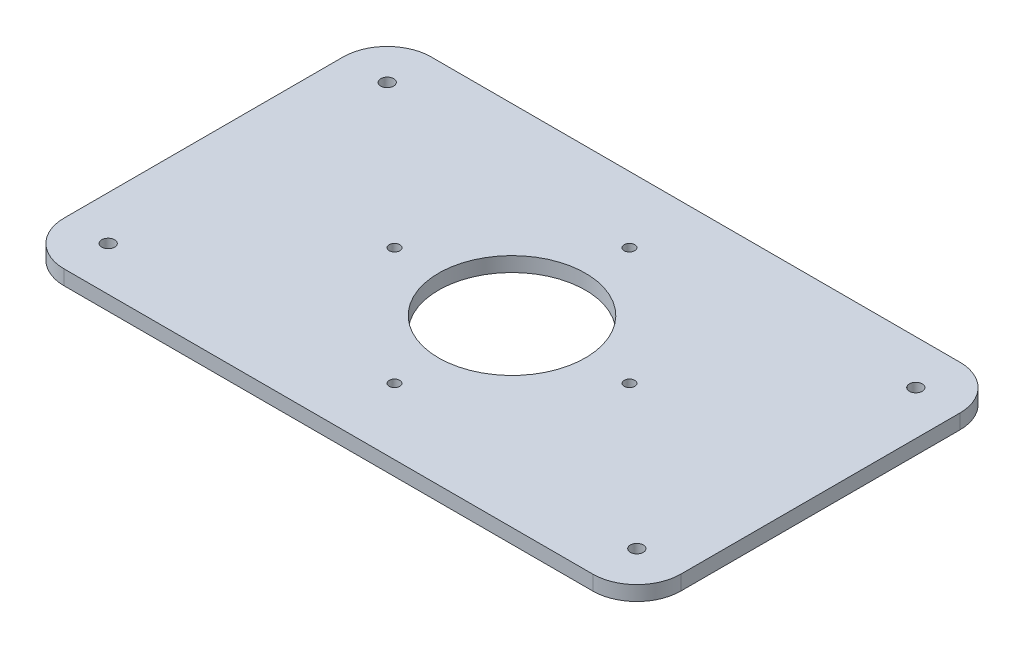
from build123d import *

# Parameters (mm, degrees)
SKETCH_1_R          = 60
SKETCH_1_R_2        = 25
EXTRUDE_1_DEPTH     = 5
SKETCH_2_R          = 1.8
CUT_EXTRUDE_1_DEPTH = 5
SKETCH_4_W          = 210
SKETCH_4_H          = 125
SKETCH_4_R          = 60
EXTRUDE_2_DEPTH     = 5
SKETCH_5_R          = 2.2
CUT_EXTRUDE_2_DEPTH = 5
FILLET_1_R          = 15


with BuildPart() as part:
    # 草图1 → 凸台-拉伸1 (new body)
    with BuildSketch(Plane(origin=(0, 0, 0), x_dir=(1, 0, 0), z_dir=(0, 1, 0))):
        with Locations(Location((0, 0, 0), (0, 0, 270))):
            Circle(SKETCH_1_R)
        with Locations(Location((0, 0, 0), (0, 0, 270))):
            Circle(SKETCH_1_R_2, mode=Mode.SUBTRACT)
    extrude(amount=EXTRUDE_1_DEPTH)

    # 草图2 → 切除-拉伸1 (cut)
    with BuildSketch(Plane(origin=(0, 5, 0), x_dir=(1, 0, 0), z_dir=(0, 1, 0))):
        with Locations(Location((0, 40, 0), (0, 0, 270))):
            Circle(SKETCH_2_R)
        with Locations(Location((40, 0, 0), (0, 0, 270))):
            Circle(SKETCH_2_R)
        with Locations(Location((0, -40, 0), (0, 0, 270))):
            Circle(SKETCH_2_R)
        with Locations(Location((-40, 0, 0), (0, 0, 270))):
            Circle(SKETCH_2_R)
    extrude(amount=-CUT_EXTRUDE_1_DEPTH, mode=Mode.SUBTRACT)

    # 草图4 → 凸台-拉伸2 (add)
    with BuildSketch(Plane(origin=(0, 0, 0), x_dir=(1, 0, 0), z_dir=(0, 1, 0))):
        Rectangle(SKETCH_4_W, SKETCH_4_H)
        Circle(SKETCH_4_R, mode=Mode.SUBTRACT)
    extrude(amount=EXTRUDE_2_DEPTH)

    # 草图5 → 切除-拉伸2 (cut)
    with BuildSketch(Plane(origin=(0, 5, 0), x_dir=(1, 0, 0), z_dir=(0, 1, 0))):
        with Locations(Location((-90, 47.5, 0), (0, 0, 270))):
            Circle(SKETCH_5_R)
        with Locations(Location((90, 47.5, 0), (0, 0, 90))):
            Circle(SKETCH_5_R)
        with Locations(Location((90, -47.5, 0), (0, 0, 270))):
            Circle(SKETCH_5_R)
        with Locations(Location((-90, -47.5, 0), (0, 0, 90))):
            Circle(SKETCH_5_R)
    extrude(amount=-CUT_EXTRUDE_2_DEPTH, mode=Mode.SUBTRACT)

    # 圆角1
    fillet_1_edges = [part.edges().sort_by_distance(p)[0] for p in [
        (-105, 2.5, -62.5),
        (-105, 2.5, 62.5),
        (105, 2.5, 62.5),
        (105, 2.5, -62.5),
    ]]
    fillet(fillet_1_edges, radius=FILLET_1_R)


solid = part.part
